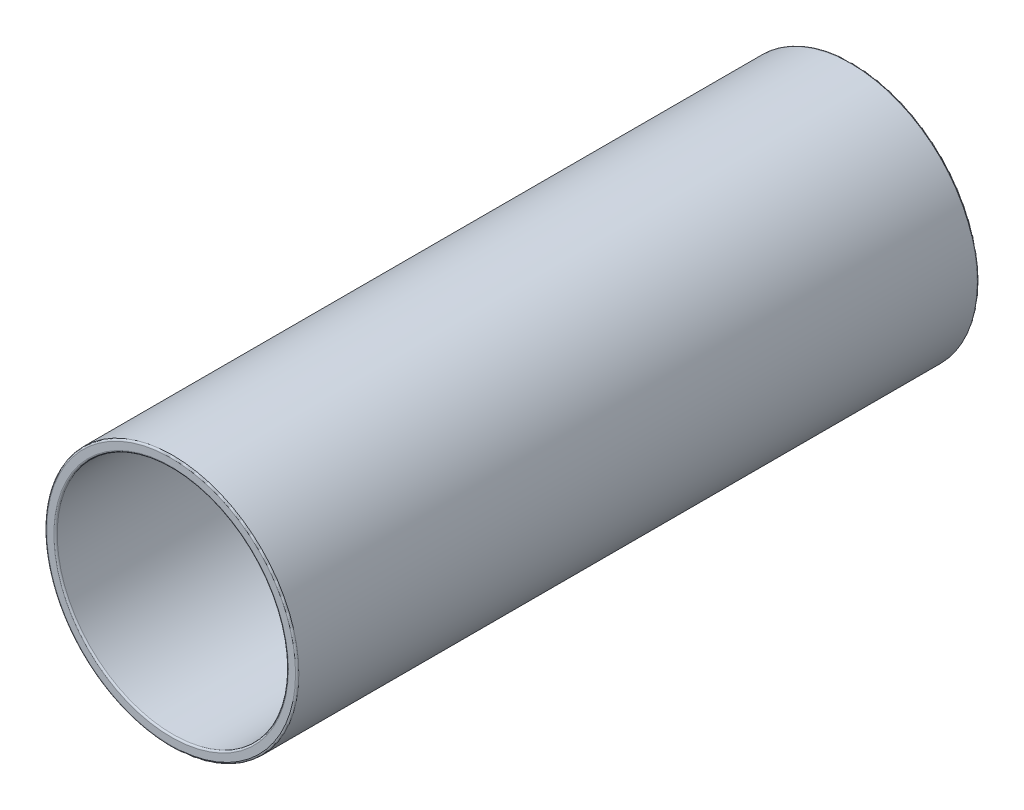
from build123d import *

# Parameters (mm, degrees)
SKETCH1_R           = 76.2
SKETCH1_R_2         = 69.85
BOSS_EXTRUDE1_DEPTH = 206
FILLET1_R           = 1


with BuildPart() as part:
    # Sketch1 → Boss-Extrude1 (new, symmetric)
    with BuildSketch(Plane.XY):
        Circle(SKETCH1_R)
        Circle(SKETCH1_R_2, mode=Mode.SUBTRACT)
    extrude(amount=BOSS_EXTRUDE1_DEPTH, both=True)

    # Fillet1
    fillet1_edges = [part.edges().sort_by_distance(p)[0] for p in [
        (-76.2, 0, -206),
        (-76.2, 0, 206),
        (-69.85, 0, -206),
        (-69.85, 0, 206),
    ]]
    fillet(fillet1_edges, radius=FILLET1_R)


solid = part.part
